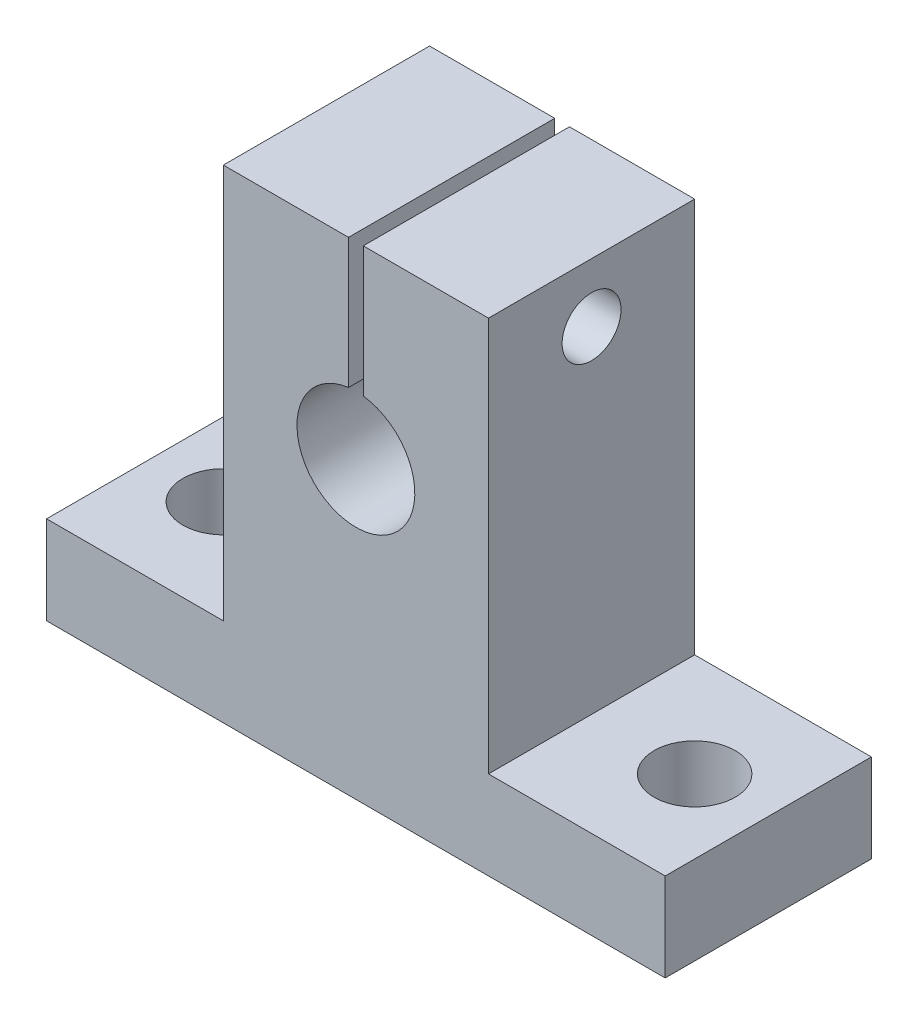
from build123d import *

# Parameters (mm, degrees)
SKETCH1_R           = 4
BOSS_EXTRUDE1_DEPTH = 14
SKETCH3_W           = 1
SKETCH3_H           = 11.790173319
CUT_EXTRUDE1_DEPTH  = 19
SKETCH2_R           = 2
CUT_EXTRUDE3_DEPTH  = 31
SKETCH5_R           = 2.75
CUT_EXTRUDE5_DEPTH  = 22


with BuildPart() as part:
    # Sketch1 → Boss-Extrude1 (new body)
    with BuildSketch(Plane.XY):
        Polygon((-21, 0), (21, 0), (21, 6), (9, 6), (9, 32.8), (-9, 32.8), (-9, 6), (-21, 6), align=None)
        with Locations((0, 20)):
            Circle(SKETCH1_R, mode=Mode.SUBTRACT)
    extrude(amount=BOSS_EXTRUDE1_DEPTH)

    # Sketch3 → Cut-Extrude1 (cut)
    with BuildSketch(Plane.XY.offset(14)):
        with Locations((0, 26.904913341)):
            Rectangle(SKETCH3_W, SKETCH3_H)
    extrude(amount=-CUT_EXTRUDE1_DEPTH, mode=Mode.SUBTRACT)

    # Sketch2 → Cut-Extrude3 (cut)
    with BuildSketch(Plane(origin=(9, 0, 0), x_dir=(0, 0, -1), z_dir=(1, 0, 0))):
        with Locations((-7, 28.8)):
            Circle(SKETCH2_R)
    extrude(amount=-CUT_EXTRUDE3_DEPTH, mode=Mode.SUBTRACT)

    # Sketch5 → Cut-Extrude5 (cut)
    with BuildSketch(Plane(origin=(0, 6, 0), x_dir=(1, 0, 0), z_dir=(0, 1, 0))):
        with Locations(Location((16, -7, 0), (0, 0, 180))):
            Circle(SKETCH5_R)
        with Locations(Location((-16, -7, 0), (0, 0, 180))):
            Circle(SKETCH5_R)
    extrude(amount=-CUT_EXTRUDE5_DEPTH, mode=Mode.SUBTRACT)


solid = part.part
